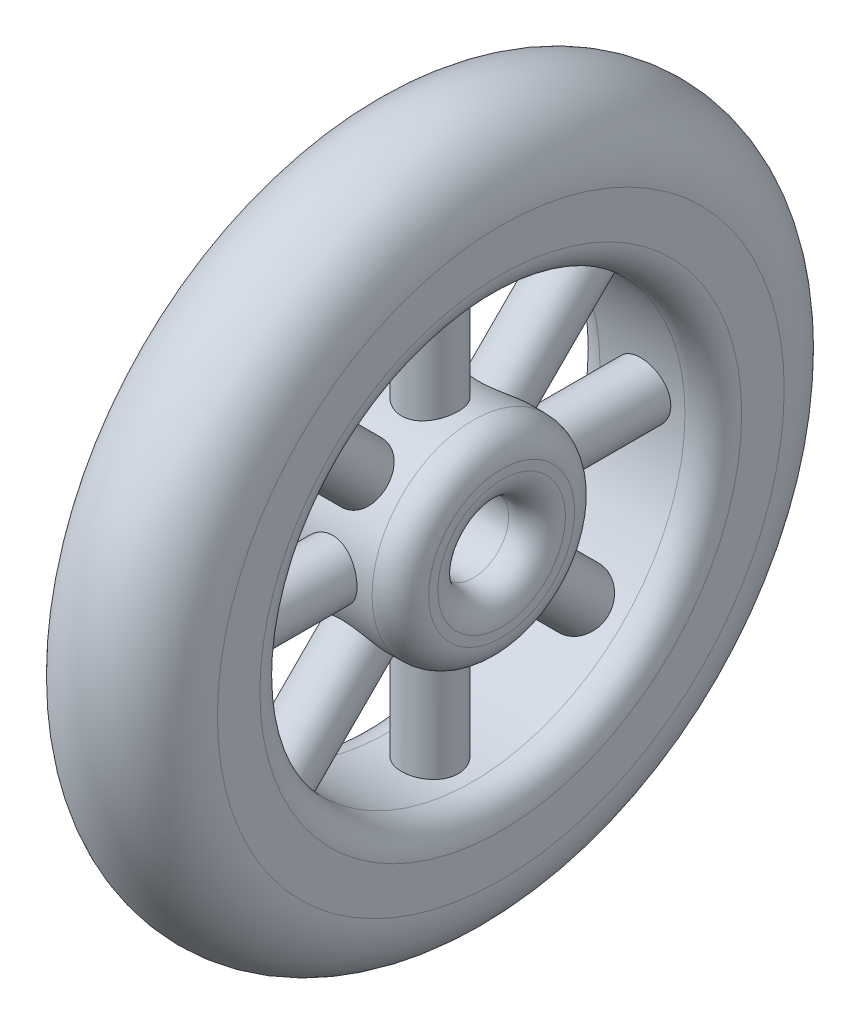
from build123d import *

# Parameters (mm, degrees)
SWEEP1_PROFILE_R  = 1.27
CIRPATTERN1_COUNT = 8


with BuildPart() as part:
    # Sketch3 → Revolve1 (revolve)
    with BuildSketch(Plane.XY, mode=Mode.PRIVATE) as revolve1_sk:
        with BuildLine():
            Line((-1.942226168, 1.5875), (1.942226168, 1.5875))
            ThreePointArc((1.942226168, 1.5875), (2.84025178, 1.959474388), (3.212226168, 2.8575))
            Line((3.212226168, 2.8575), (3.212226168, 3.268158252))
            ThreePointArc((3.212226168, 3.268158252), (2.84025178, 4.166183864), (1.942226168, 4.538158252))
            Line((1.942226168, 4.538158252), (-1.942226168, 4.538158252))
            ThreePointArc((-1.942226168, 4.538158252), (-2.84025178, 4.166183864), (-3.212226168, 3.268158252))
            Line((-3.212226168, 3.268158252), (-3.212226168, 2.8575))
            ThreePointArc((-3.212226168, 2.8575), (-2.84025178, 1.959474388), (-1.942226168, 1.5875))
        make_face()
        with BuildLine():
            Line((-3.175, 12.7), (-3.175, 10.795))
            ThreePointArc((-3.175, 10.795), (-2.803025612, 9.896974388), (-1.905, 9.525))
            Line((-1.905, 9.525), (1.905, 9.525))
            ThreePointArc((1.905, 9.525), (2.803025612, 9.896974388), (3.175, 10.795))
            Line((3.175, 10.795), (3.175, 12.7))
            ThreePointArc((3.175, 12.7), (0, 15.875), (-3.175, 12.7))
        make_face()
    revolve(revolve1_sk.sketch.rotate(Axis((-11.977214198, 0, 0), (1, 0, 0)), 90), axis=Axis((-11.977214198, 0, 0), (1, 0, 0)))

    # Sweep1: sweep along a path in Sketch5
    with BuildLine(Plane(origin=(0, 0, 0), x_dir=(0, 0, -1), z_dir=(1, 0, 0))) as sweep1_path:
        Line((0, 3.062829126), (0, 12.7))
    # Sweep1 profile (on start of the path) → Sweep1 (sweep)
    with BuildSketch(Plane.ZX.offset(3.062829126)):
        Circle(SWEEP1_PROFILE_R)
    sweep1 = sweep(path=sweep1_path.line)

    # CirPattern1: Sweep1 ×8 about axis
    cirpattern1_axis = Axis((-11.977214198, 0, 0), (1, 0, 0))
    for i in range(1, CIRPATTERN1_COUNT):
        add(sweep1.rotate(cirpattern1_axis, i * 360 / CIRPATTERN1_COUNT))


solid = part.part
